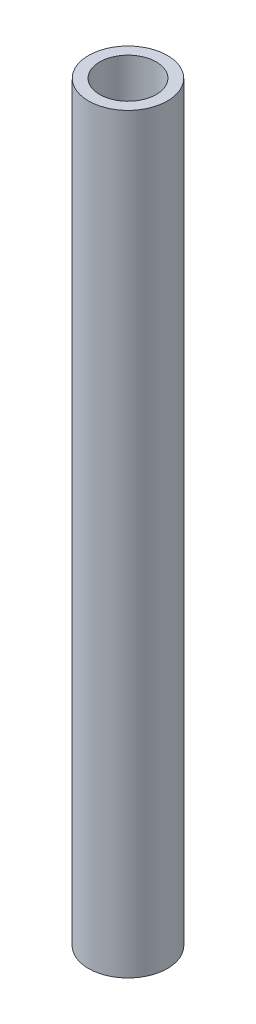
from build123d import *

# Parameters (mm, degrees)
SKETCH1_R           = 10.668
SKETCH1_R_2         = 7.6454
BOSS_EXTRUDE1_DEPTH = 203.2


with BuildPart() as part:
    # Sketch1 → Boss-Extrude1 (new body)
    with BuildSketch(Plane(origin=(0, 0, 0), x_dir=(1, 0, 0), z_dir=(0, 1, 0))):
        with Locations(Location((0, 0, 0), (0, 0, 270))):
            Circle(SKETCH1_R)
        with Locations(Location((0, 0, 0), (0, 0, 270))):
            Circle(SKETCH1_R_2, mode=Mode.SUBTRACT)
    extrude(amount=BOSS_EXTRUDE1_DEPTH)


solid = part.part
